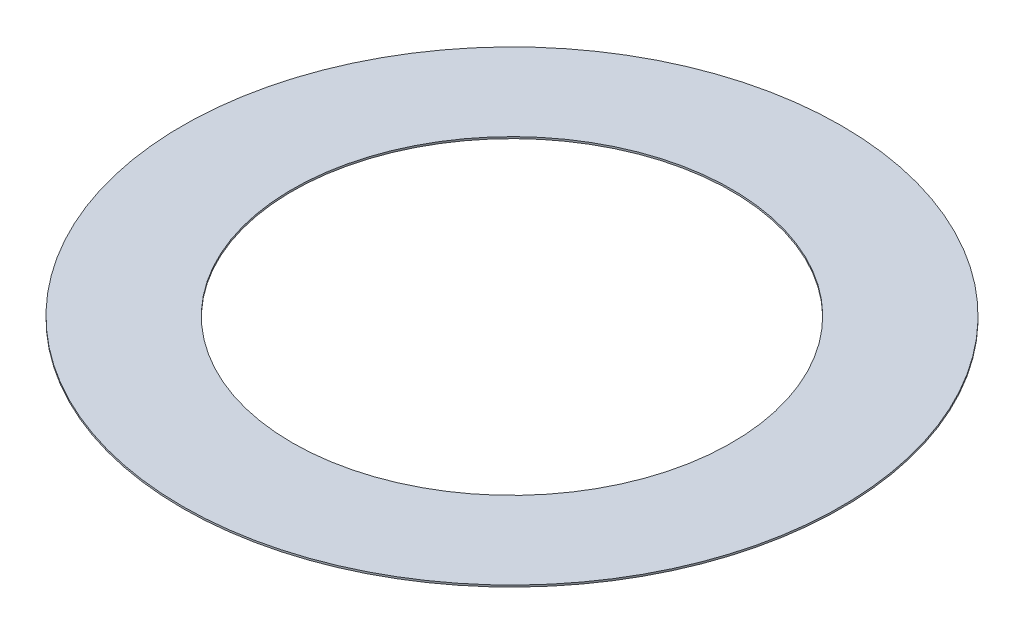
from build123d import *

# Parameters (mm, degrees)
SKETCH1_R           = 4.7625
SKETCH1_R_2         = 3.175
BOSS_EXTRUDE1_DEPTH = 0.0254


with BuildPart() as part:
    # Sketch1 → Boss-Extrude1 (new body)
    with BuildSketch(Plane(origin=(0, 0, 0), x_dir=(1, 0, 0), z_dir=(0, 1, 0))):
        with Locations(Location((0, 0, 0), (0, 0, 270))):
            Circle(SKETCH1_R)
        with Locations(Location((0, 0, 0), (0, 0, 270))):
            Circle(SKETCH1_R_2, mode=Mode.SUBTRACT)
    extrude(amount=BOSS_EXTRUDE1_DEPTH)


solid = part.part
